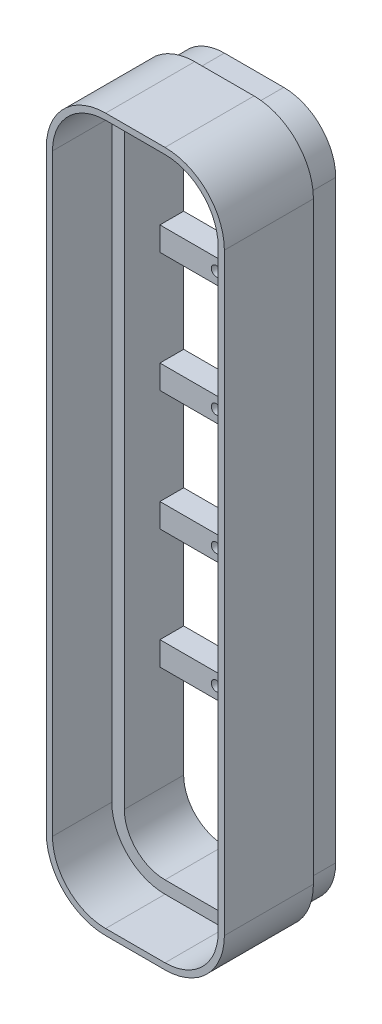
from build123d import *

# Parameters (mm, degrees)
SKETCH1_W               = 38.1
SKETCH1_H               = 152.4
BOSS_EXTRUDE1_DEPTH     = 12.7
FILLET1_R               = 12.7
CUT_EXTRUDE1_DEPTH      = 83.55
EXTRUDE_THIN1_START     = -12.7
EXTRUDE_THIN1_DEPTH     = 12.7
CUT_EXTRUDE2_DEPTH      = 6.35
SKETCH6_W               = 35.1984056
SKETCH6_H               = 5.08
SKETCH6_R               = 1.054294776
BOSS_EXTRUDE2_DEPTH     = 5.08
CLEARANCE_1_DEPTH       = 6.35
CUT_EXTRUDE_THIN2_START = -12.7
CUT_EXTRUDE_THIN2_DEPTH = 12.7


with BuildPart() as part:
    # Sketch1 → Boss-Extrude1 (new, symmetric)
    with BuildSketch(Plane.XY):
        Rectangle(SKETCH1_W, SKETCH1_H)
    extrude(amount=BOSS_EXTRUDE1_DEPTH, both=True)

    # Fillet1
    fillet1_edges = [part.edges().sort_by_distance(p)[0] for p in [
        (19.05, -76.2, 0),
        (-19.05, -76.2, 0),
        (-19.05, 76.2, 0),
        (19.05, 76.2, 0),
    ]]
    fillet(fillet1_edges, radius=FILLET1_R)

    # Sketch2 → Cut-Extrude1 (cut, through all)
    with BuildSketch(Plane.XY.offset(12.7)):
        with BuildLine():
            Line((-17.599200768, 63.5), (-17.599200768, -63.5))
            ThreePointArc((-17.599200768, -63.5), (-14.304386146, -71.454386146), (-6.35, -74.749200768))
            Line((-6.35, -74.749200768), (6.35, -74.749200768))
            ThreePointArc((6.35, -74.749200768), (14.304386146, -71.454386146), (17.599200768, -63.5))
            Line((17.599200768, -63.5), (17.599200768, 63.5))
            ThreePointArc((17.599200768, 63.5), (14.304386146, 71.454386146), (6.35, 74.749200768))
            Line((6.35, 74.749200768), (-6.35, 74.749200768))
            ThreePointArc((-6.35, 74.749200768), (-14.304386146, 71.454386146), (-17.599200768, 63.5))
        make_face()
    extrude(amount=-CUT_EXTRUDE1_DEPTH, mode=Mode.SUBTRACT)

    # Sketch3 → Extrude-Thin1 (add)
    with BuildSketch(Plane(origin=(0, 0, -12.7), x_dir=(-1, 0, 0), z_dir=(0, 0, -1)).offset(EXTRUDE_THIN1_START)):
        with BuildLine():
            Line((-6.35, 74.749200768), (6.35, 74.749200768))
            ThreePointArc((6.35, 74.749200768), (14.304386146, 71.454386146), (17.599200768, 63.5))
            Line((17.599200768, 63.5), (17.599200768, -63.5))
            ThreePointArc((17.599200768, -63.5), (14.304386146, -71.454386146), (6.35, -74.749200768))
            Line((6.35, -74.749200768), (-6.35, -74.749200768))
            ThreePointArc((-6.35, -74.749200768), (-14.304386146, -71.454386146), (-17.599200768, -63.5))
            Line((-17.599200768, -63.5), (-17.599200768, 63.5))
            ThreePointArc((-17.599200768, 63.5), (-14.304386146, 71.454386146), (-6.35, 74.749200768))
        make_face()
        with BuildLine():
            Line((-6.35, 72.209200768), (6.35, 72.209200768))
            ThreePointArc((6.35, 72.209200768), (12.508334922, 69.658334922), (15.059200768, 63.5))
            Line((15.059200768, 63.5), (15.059200768, -63.5))
            ThreePointArc((15.059200768, -63.5), (12.508334922, -69.658334922), (6.35, -72.209200768))
            Line((6.35, -72.209200768), (-6.35, -72.209200768))
            ThreePointArc((-6.35, -72.209200768), (-12.508334922, -69.658334922), (-15.059200768, -63.5))
            Line((-15.059200768, -63.5), (-15.059200768, 63.5))
            ThreePointArc((-15.059200768, 63.5), (-12.508334922, 69.658334922), (-6.35, 72.209200768))
        make_face(mode=Mode.SUBTRACT)
    extrude(amount=EXTRUDE_THIN1_DEPTH)

    # Sketch4 → Cut-Extrude2 (cut)
    with BuildSketch(Plane(origin=(0, 0, -12.7), x_dir=(-1, 0, 0), z_dir=(0, 0, -1))):
        with BuildLine():
            Line((6.35, -76.2), (-6.35, -76.2))
            ThreePointArc((-6.35, -76.2), (-15.330256121, -72.480256121), (-19.05, -63.5))
            Line((-19.05, -63.5), (-19.05, 63.5))
            ThreePointArc((-19.05, 63.5), (-15.330256121, 72.480256121), (-6.35, 76.2))
            Line((-6.35, 76.2), (6.35, 76.2))
            ThreePointArc((6.35, 76.2), (15.330256121, 72.480256121), (19.05, 63.5))
            Line((19.05, 63.5), (19.05, -63.5))
            ThreePointArc((19.05, -63.5), (15.330256121, -72.480256121), (6.35, -76.2))
        make_face()
        with BuildLine():
            Line((-17.5992028, -63.5), (-17.5992028, 63.5))
            ThreePointArc((-17.5992028, 63.5), (-14.304387583, 71.454387583), (-6.35, 74.7492028))
            Line((-6.35, 74.7492028), (6.35, 74.7492028))
            ThreePointArc((6.35, 74.7492028), (14.304387583, 71.454387583), (17.5992028, 63.5))
            Line((17.5992028, 63.5), (17.5992028, -63.5))
            ThreePointArc((17.5992028, -63.5), (14.304387583, -71.454387583), (6.35, -74.7492028))
            Line((6.35, -74.7492028), (-6.35, -74.7492028))
            ThreePointArc((-6.35, -74.7492028), (-14.304387583, -71.454387583), (-17.5992028, -63.5))
        make_face(mode=Mode.SUBTRACT)
    extrude(amount=-CUT_EXTRUDE2_DEPTH, mode=Mode.SUBTRACT)

    # Sketch6 → Boss-Extrude2 (add)
    # profile 1 of 4: a face of its own
    with BuildSketch(Plane(origin=(0, 0, -7.62), x_dir=(-1, 0, 0), z_dir=(0, 0, -1))):
        with Locations((0, 38.431496192)):
            Rectangle(SKETCH6_W, SKETCH6_H)
        with Locations((3.015690418, 38.431496192)):
            Circle(SKETCH6_R, mode=Mode.SUBTRACT)
    # profile 2 of 4: a face of its own
    with BuildSketch(Plane(origin=(0, 0, -7.62), x_dir=(-1, 0, 0), z_dir=(0, 0, -1))):
        with Locations((0, 12.839006486)):
            Rectangle(SKETCH6_W, SKETCH6_H)
        with Locations((3.015690418, 12.839006486)):
            Circle(SKETCH6_R, mode=Mode.SUBTRACT)
    # profile 3 of 4: a face of its own
    with BuildSketch(Plane(origin=(0, 0, -7.62), x_dir=(-1, 0, 0), z_dir=(0, 0, -1))):
        with Locations((0, -12.818503808)):
            Rectangle(SKETCH6_W, SKETCH6_H)
        with Locations((3.015690418, -12.818503808)):
            Circle(SKETCH6_R, mode=Mode.SUBTRACT)
    # profile 4 of 4: a face of its own
    with BuildSketch(Plane(origin=(0, 0, -7.62), x_dir=(-1, 0, 0), z_dir=(0, 0, -1))):
        with Locations((0, -38.410993514)):
            Rectangle(SKETCH6_W, SKETCH6_H)
        with Locations((3.015690418, -38.410993514)):
            Circle(SKETCH6_R, mode=Mode.SUBTRACT)
    extrude(amount=BOSS_EXTRUDE2_DEPTH)

    # Sketch7 → Clearance 1 (cut)
    with BuildSketch(Plane(origin=(0, 0, -12.7), x_dir=(-1, 0, 0), z_dir=(0, 0, -1))):
        with BuildLine():
            Line((-17.5992028, 63.5), (-17.5992028, -63.5))
            ThreePointArc((-17.5992028, -63.5), (-14.304387583, -71.454387583), (-6.35, -74.7492028))
            Line((-6.35, -74.7492028), (6.35, -74.7492028))
            ThreePointArc((6.35, -74.7492028), (14.304387583, -71.454387583), (17.5992028, -63.5))
            Line((17.5992028, -63.5), (17.5992028, 63.5))
            ThreePointArc((17.5992028, 63.5), (14.304387583, 71.454387583), (6.35, 74.7492028))
            Line((6.35, 74.7492028), (-6.35, 74.7492028))
            ThreePointArc((-6.35, 74.7492028), (-14.304387583, 71.454387583), (-17.5992028, 63.5))
        make_face()
        with BuildLine():
            Line((-17.4722028, 63.5), (-17.4722028, -63.5))
            ThreePointArc((-17.4722028, -63.5), (-14.214585022, -71.364585022), (-6.35, -74.6222028))
            Line((-6.35, -74.6222028), (6.35, -74.6222028))
            ThreePointArc((6.35, -74.6222028), (14.214585022, -71.364585022), (17.4722028, -63.5))
            Line((17.4722028, -63.5), (17.4722028, 63.5))
            ThreePointArc((17.4722028, 63.5), (14.214585022, 71.364585022), (6.35, 74.6222028))
            Line((6.35, 74.6222028), (-6.35, 74.6222028))
            ThreePointArc((-6.35, 74.6222028), (-14.214585022, 71.364585022), (-17.4722028, 63.5))
        make_face(mode=Mode.SUBTRACT)
    extrude(amount=-CLEARANCE_1_DEPTH, mode=Mode.SUBTRACT)

    # Sketch8 → Cut-Extrude-Thin2 (cut)
    with BuildSketch(Plane.XY.offset(12.7).offset(CUT_EXTRUDE_THIN2_START)):
        with BuildLine():
            Line((-17.726200768, 63.5), (-17.726200768, -63.5))
            ThreePointArc((-17.726200768, -63.5), (-14.394188707, -71.544188707), (-6.35, -74.876200768))
            Line((-6.35, -74.876200768), (6.35, -74.876200768))
            ThreePointArc((6.35, -74.876200768), (14.394188707, -71.544188707), (17.726200768, -63.5))
            Line((17.726200768, -63.5), (17.726200768, 63.5))
            ThreePointArc((17.726200768, 63.5), (14.394188707, 71.544188707), (6.35, 74.876200768))
            Line((6.35, 74.876200768), (-6.35, 74.876200768))
            ThreePointArc((-6.35, 74.876200768), (-14.394188707, 71.544188707), (-17.726200768, 63.5))
        make_face()
        with BuildLine():
            Line((-17.599200768, 63.5), (-17.599200768, -63.5))
            ThreePointArc((-17.599200768, -63.5), (-14.304386146, -71.454386146), (-6.35, -74.749200768))
            Line((-6.35, -74.749200768), (6.35, -74.749200768))
            ThreePointArc((6.35, -74.749200768), (14.304386146, -71.454386146), (17.599200768, -63.5))
            Line((17.599200768, -63.5), (17.599200768, 63.5))
            ThreePointArc((17.599200768, 63.5), (14.304386146, 71.454386146), (6.35, 74.749200768))
            Line((6.35, 74.749200768), (-6.35, 74.749200768))
            ThreePointArc((-6.35, 74.749200768), (-14.304386146, 71.454386146), (-17.599200768, 63.5))
        make_face(mode=Mode.SUBTRACT)
    extrude(amount=CUT_EXTRUDE_THIN2_DEPTH, mode=Mode.SUBTRACT)


solid = part.part
